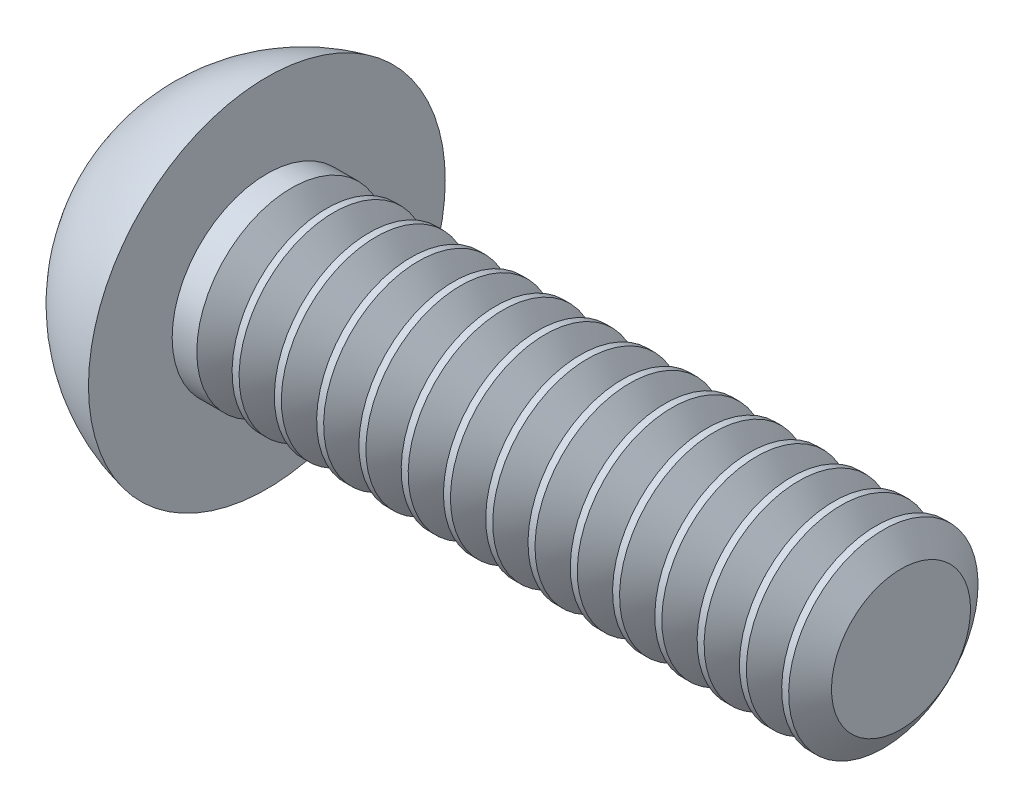
from build123d import *

# Parameters (mm, degrees)
CIRPATTERN1_COUNT = 2
CIRPATTERN1_ANGLE = 90
THDSCHPAT_COUNT   = 15
THDSCHPAT_PITCH   = 0.635


with BuildPart() as part:
    # BodySke → Base-Revolve (revolve)
    with BuildSketch(Plane.XY):
        with BuildLine():
            Line((11.7094, 0), (11.7094, 1.4224))
            Line((11.7094, 1.4224), (2.1844, 1.4224))
            Line((2.1844, 1.4224), (2.1844, 2.6797))
            ThreePointArc((2.1844, 2.6797), (0.615288684, 1.728611831), (0, 0))
            Line((0, 0), (11.7094, 0))
        make_face()
    revolve(axis=Axis((0, 0, 0), (1, 0, 0)))

    # Sketch3 → Cross section 0
    with BuildSketch(Plane(origin=(0, 0, 0), x_dir=(0, 0, -1), z_dir=(1, 0, 0))):
        with BuildLine():
            Line((0.3683, -1.7399), (-0.3683, -1.7399))
            Line((-0.3683, -1.7399), (-0.3683, 1.7399))
            Line((-0.3683, 1.7399), (0.3683, 1.7399))
            Line((0.3683, 1.7399), (0.3683, -1.7399))
        make_face()
    # Sketch4 → Cross section 1
    with BuildSketch(Plane(origin=(1.9558, 0, 0), x_dir=(0, 0, -1), z_dir=(1, 0, 0))):
        with BuildLine():
            Line((0.18415, -0.18415), (-0.18415, -0.18415))
            Line((-0.18415, -0.18415), (-0.18415, 0.18415))
            Line((-0.18415, 0.18415), (0.18415, 0.18415))
            Line((0.18415, 0.18415), (0.18415, -0.18415))
        make_face()
    cross = loft(mode=Mode.SUBTRACT)

    # CirPattern1: Cross ×2 about axis
    cirpattern1_axis = Axis((0, 0, 0), (1, 0, 0))
    for i in range(1, CIRPATTERN1_COUNT):
        add(cross.rotate(cirpattern1_axis, i * CIRPATTERN1_ANGLE / (CIRPATTERN1_COUNT - 1)), mode=Mode.SUBTRACT)

    # ThdSchSke → ThreadSchematic (revolve, cut)
    with BuildSketch(Plane.XY, mode=Mode.PRIVATE) as threadschematic_sk:
        Polygon((2.8194, -1.04394), (2.554399455, -1.4224), (2.554399455, -1.778), (3.084400545, -1.778), (3.084400545, -1.4224), align=None)
    threadschematic = revolve(threadschematic_sk.sketch.rotate(Axis((-3.175, 0, 0), (1, 0, 0)), 270), axis=Axis((-3.175, 0, 0), (1, 0, 0)), mode=Mode.SUBTRACT)

    # ThdSchPat: ThreadSchematic ×15
    with Locations(*[(i * THDSCHPAT_PITCH, 0, 0) for i in range(1, THDSCHPAT_COUNT)]):
        add(threadschematic, mode=Mode.SUBTRACT)


solid = part.part
